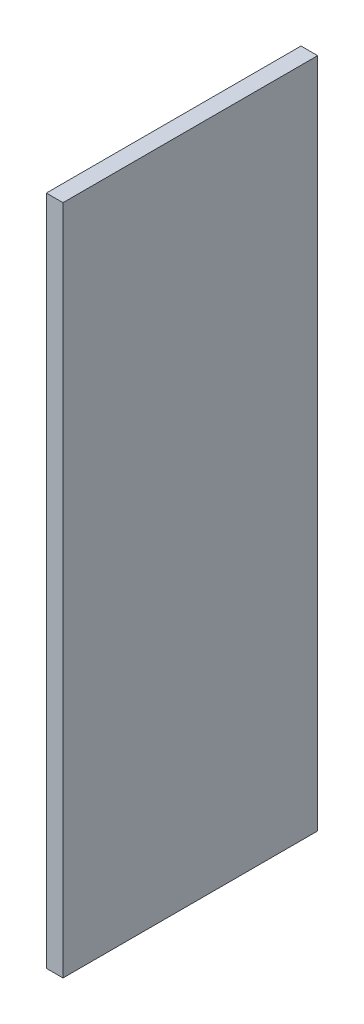
from build123d import *

# Parameters (mm, degrees)
SKETCH1_W           = 279.4
SKETCH1_H           = 736.6
BOSS_EXTRUDE1_DEPTH = 18.288


with BuildPart() as part:
    # Sketch1 → Boss-Extrude1 (new body)
    with BuildSketch(Plane(origin=(0, 0, 0), x_dir=(0, 0, -1), z_dir=(1, 0, 0))):
        Rectangle(SKETCH1_W, SKETCH1_H)
    extrude(amount=BOSS_EXTRUDE1_DEPTH)


solid = part.part
